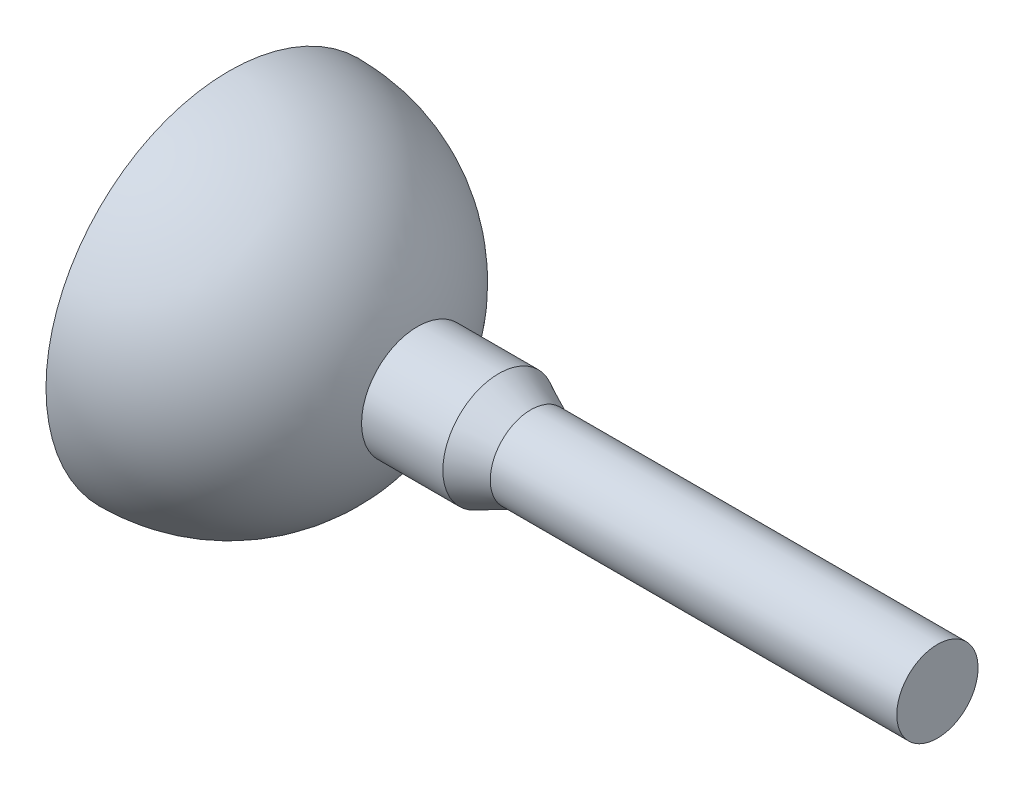
from build123d import *


with BuildPart() as part:
    # 草图1 → 旋转1 (revolve)
    with BuildSketch(Plane.XY, mode=Mode.PRIVATE) as revolve_1_sk:
        with BuildLine():
            Line((-1.169024225, 2), (-1.169024225, 2.75))
            Line((-1.169024225, 2.75), (2.830975775, 2.75))
            Line((2.830975775, 2.75), (4.412054598, 2))
            Line((4.412054598, 2), (24.412054598, 2))
            Line((24.412054598, 2), (24.412054598, 0))
            Line((24.412054598, 0), (-10.443988612, 0))
            Line((-10.443988612, 0), (-10.443988612, 9))
            ThreePointArc((-10.443988612, 9), (-4.831502532, 7.03562364), (-1.669024225, 2))
            Line((-1.669024225, 2), (-1.169024225, 2))
        make_face()
    revolve(revolve_1_sk.sketch.rotate(Axis((0, 0, 0), (1, 0, 0)), 90), axis=Axis((0, 0, 0), (1, 0, 0)))


solid = part.part
